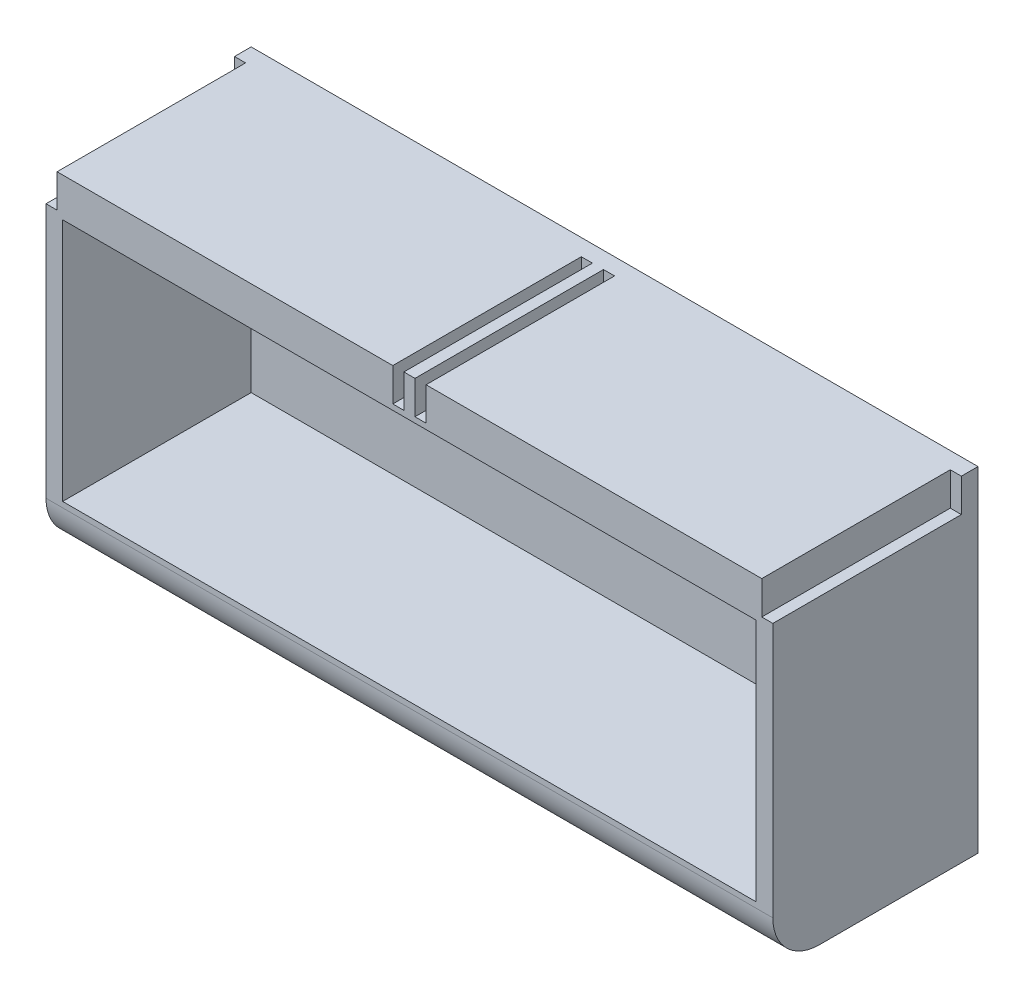
from build123d import *

# Parameters (mm, degrees)
CROQUIS2_W              = 131.1
CROQUIS2_H              = 54
SALIENTE_EXTRUIR2_DEPTH = 3
CROQUIS3_W              = 125.1
CROQUIS3_H              = 44
SALIENTE_EXTRUIR3_DEPTH = 34
CROQUIS4_W              = 131.1
CROQUIS4_H              = 37
SALIENTE_EXTRUIR4_DEPTH = 6.4
REDONDEO2_R             = 8.4


with BuildPart() as part:
    # Croquis2 → Saliente-Extruir2 (new body)
    with BuildSketch(Plane.XY):
        with Locations((65.55, -27)):
            Rectangle(CROQUIS2_W, CROQUIS2_H)
    extrude(amount=SALIENTE_EXTRUIR2_DEPTH)

    # Croquis3 → Saliente-Extruir3 (add)
    with BuildSketch(Plane.XY.offset(3)):
        Polygon((2, -6), (0, -6), (0, -54), (131.1, -54), (131.1, -6), (129.1, -6), (129.1, 0), (68.55, 0), (68.55, -6), (66.55, -6), (66.55, 0), (65.55, 0), (64.55, 0), (64.55, -6), (62.55, -6), (62.55, 0), (2, 0), align=None)
        with Locations((65.55, -29)):
            Rectangle(CROQUIS3_W, CROQUIS3_H, mode=Mode.SUBTRACT)
    extrude(amount=SALIENTE_EXTRUIR3_DEPTH)

    # Croquis4 → Saliente-Extruir4 (add)
    with BuildSketch(Plane.XZ.offset(54)):
        with Locations((65.55, 18.5)):
            Rectangle(CROQUIS4_W, CROQUIS4_H)
    extrude(amount=SALIENTE_EXTRUIR4_DEPTH)

    # Redondeo2
    redondeo2_edges = [part.edges().sort_by_distance(p)[0] for p in [
        (65.55, -60.4, 37),
    ]]
    fillet(redondeo2_edges, radius=REDONDEO2_R)


solid = part.part
